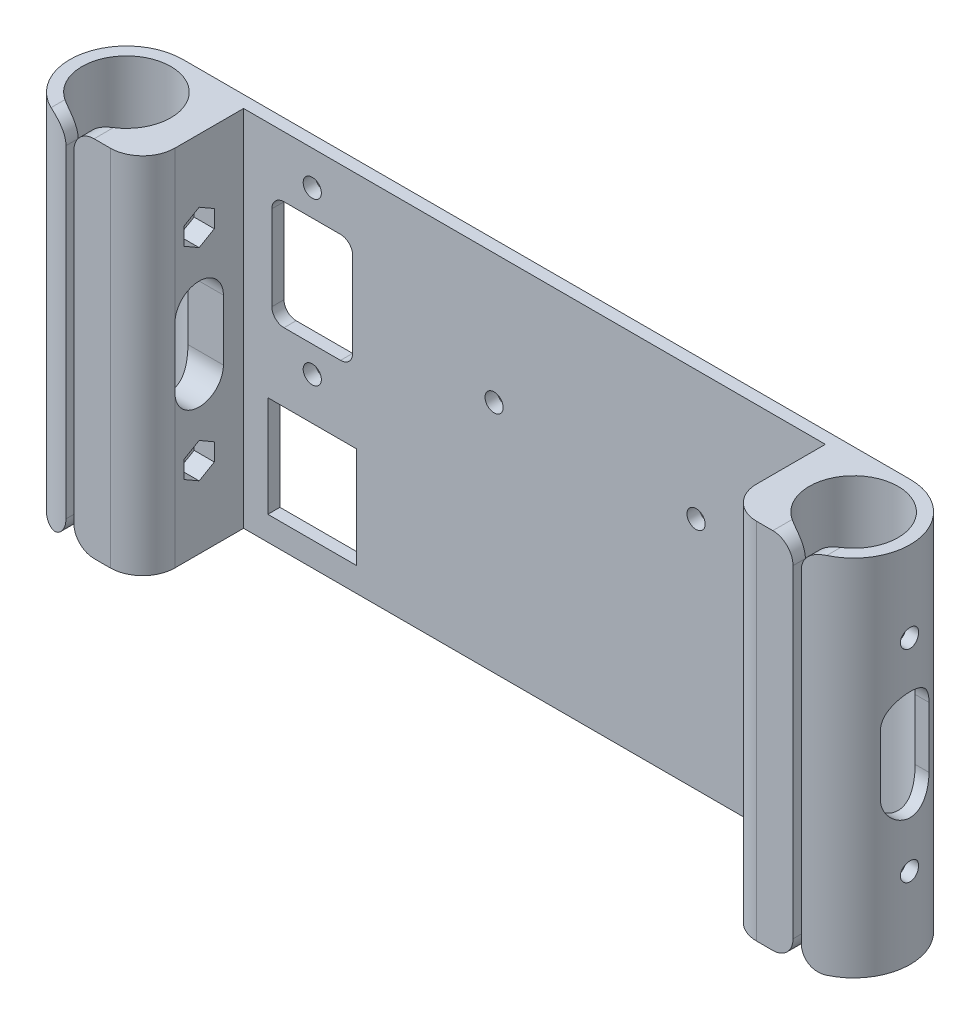
from build123d import *

# Parameters (mm, degrees)
SKETCH1_R               = 11
BOSS_EXTRUDE1_DEPTH     = 90
FILLET1_R               = 8
SKETCH2_R               = 2.25
CUT_EXTRUDE1_DEPTH      = 10
SKETCH3_R               = 2.25
SKETCH3_W               = 20
SKETCH3_H               = 27
CUT_EXTRUDE2_DEPTH      = 10
FILLET2_R               = 3
SKETCH4_W               = 22
SKETCH4_H               = 25
CUT_EXTRUDE3_DEPTH      = 10
SKETCH5_W               = 2
SKETCH5_H               = 90
CUT_EXTRUDE_THIN1_DEPTH = 10
FILLET3_R               = 5
CUT_EXTRUDE4_DEPTH      = 199.207593336
CUT_EXTRUDE4_DEPTH_BACK = 199.207593336
SKETCH7_R               = 2.25
CUT_EXTRUDE5_DEPTH      = 5


with BuildPart() as part:
    # Sketch1 → Boss-Extrude1 (new body)
    with BuildSketch(Plane(origin=(0, 0, 0), x_dir=(1, 0, 0), z_dir=(0, 1, 0))):
        with BuildLine():
            Line((137.460581558, -14.5), (119.460581558, -14.5))
            Line((119.460581558, -14.5), (119.460581558, 10.5))
            Line((119.460581558, 10.5), (-24.539418442, 10.5))
            Line((-24.539418442, 10.5), (-24.539418442, -14.5))
            Line((-24.539418442, -14.5), (-42.539418442, -14.5))
            ThreePointArc((-42.539418442, -14.5), (-56.539418442, -0.5), (-42.539418442, 13.5))
            Line((-42.539418442, 13.5), (137.460581558, 13.5))
            ThreePointArc((137.460581558, 13.5), (151.460581558, -0.5), (137.460581558, -14.5))
        make_face()
        with Locations(Location((-42.539418442, -0.5, 0), (0, 0, 90))):
            Circle(SKETCH1_R, mode=Mode.SUBTRACT)
        with Locations(Location((137.460581558, -0.5, 0), (0, 0, 90))):
            Circle(SKETCH1_R, mode=Mode.SUBTRACT)
    extrude(amount=BOSS_EXTRUDE1_DEPTH)

    # Fillet1
    fillet1_edges = [part.edges().sort_by_distance(p)[0] for p in [
        (119.460581558, 45, 14.5),
        (-24.539418442, 45, 14.5),
    ]]
    fillet(fillet1_edges, radius=FILLET1_R)

    # Sketch2 → Cut-Extrude1 (cut)
    with BuildSketch(Plane.XY.offset(-10.5)):
        with Locations((87.460581558, 58)):
            Circle(SKETCH2_R)
        with Locations((37.460581558, 58)):
            Circle(SKETCH2_R)
    extrude(amount=-CUT_EXTRUDE1_DEPTH, mode=Mode.SUBTRACT)

    # Sketch3 → Cut-Extrude2 (cut)
    with BuildSketch(Plane.XY.offset(-10.5)):
        with Locations((-7.539418442, 41.5)):
            Circle(SKETCH3_R)
        with Locations((-7.539418442, 81.5)):
            Circle(SKETCH3_R)
        with Locations((-7.539418442, 61.5)):
            Rectangle(SKETCH3_W, SKETCH3_H)
    extrude(amount=-CUT_EXTRUDE2_DEPTH, mode=Mode.SUBTRACT)

    # Fillet2
    fillet2_edges = [part.edges().sort_by_distance(p)[0] for p in [
        (2.460581558, 75, -12),
        (2.460581558, 48, -12),
        (-17.539418442, 48, -12),
        (-17.539418442, 75, -12),
    ]]
    fillet(fillet2_edges, radius=FILLET2_R)

    # Sketch4 → Cut-Extrude3 (cut)
    with BuildSketch(Plane(origin=(0, 0, -13.5), x_dir=(-1, 0, 0), z_dir=(0, 0, -1))):
        with Locations((7.539418442, 18.5)):
            Rectangle(SKETCH4_W, SKETCH4_H)
    extrude(amount=-CUT_EXTRUDE3_DEPTH, mode=Mode.SUBTRACT)

    # Sketch5 → Cut-Extrude-Thin1 (cut)
    with BuildSketch(Plane.XY.offset(14.5)):
        with Locations((-42.539418442, 45)):
            Rectangle(SKETCH5_W, SKETCH5_H)
        with Locations((137.460581558, 45)):
            Rectangle(SKETCH5_W, SKETCH5_H)
    extrude(amount=-CUT_EXTRUDE_THIN1_DEPTH, mode=Mode.SUBTRACT)

    # Fillet3
    fillet3_edges = [part.edges().sort_by_distance(p)[0] for p in [
        (-43.539418442, 0, 12.959345597),
        (-43.539418442, 90, 12.959345597),
        (-41.539418442, 0, 12.977225575),
        (-41.539418442, 90, 12.977225575),
        (136.460581558, 90, 12.977225575),
        (138.460581558, 90, 12.959345597),
        (138.460581558, 0, 12.959345597),
        (136.460581558, 0, 12.977225575),
    ]]
    fillet(fillet3_edges, radius=FILLET3_R)

    # Sketch7 → Cut-Extrude4 (cut, two sides: drawn at the far end of the back side and taken through both)
    with BuildSketch(Plane(origin=(-24.539418442, 0, 0), x_dir=(0, 0, -1), z_dir=(1, 0, 0)).offset(-CUT_EXTRUDE4_DEPTH_BACK)):
        with Locations((-0.5, 70)):
            Circle(SKETCH7_R)
        with Locations((-0.5, 20)):
            Circle(SKETCH7_R)
        with BuildLine():
            Line((5.5, 52.5), (5.5, 37.5))
            ThreePointArc((5.5, 37.5), (-0.5, 31.5), (-6.5, 37.5))
            Line((-6.5, 37.5), (-6.5, 52.5))
            ThreePointArc((-6.5, 52.5), (-0.5, 58.5), (5.5, 52.5))
        make_face()
    extrude(amount=CUT_EXTRUDE4_DEPTH + CUT_EXTRUDE4_DEPTH_BACK, mode=Mode.SUBTRACT)

    # Sketch8 → Cut-Extrude5 (cut)
    with BuildSketch(Plane(origin=(-24.539418442, 0, 0), x_dir=(0, 0, -1), z_dir=(1, 0, 0))):
        Polygon((-0.5, 74.330127019), (-4.25, 72.165063509), (-4.25, 67.834936491), (-0.5, 65.669872981), (3.25, 67.834936491), (3.25, 72.165063509), align=None)
        Polygon((-0.5, 24.330127019), (-4.25, 22.165063509), (-4.25, 17.834936491), (-0.5, 15.669872981), (3.25, 17.834936491), (3.25, 22.165063509), align=None)
    cut_extrude5 = extrude(amount=-CUT_EXTRUDE5_DEPTH, mode=Mode.SUBTRACT)

    # Mirror1: Cut-Extrude5 across plane
    add(cut_extrude5.mirror(Plane(origin=(47.460581558, 0, 0), x_dir=(0, 0, 1), z_dir=(1, 0, 0))), mode=Mode.SUBTRACT)


solid = part.part
